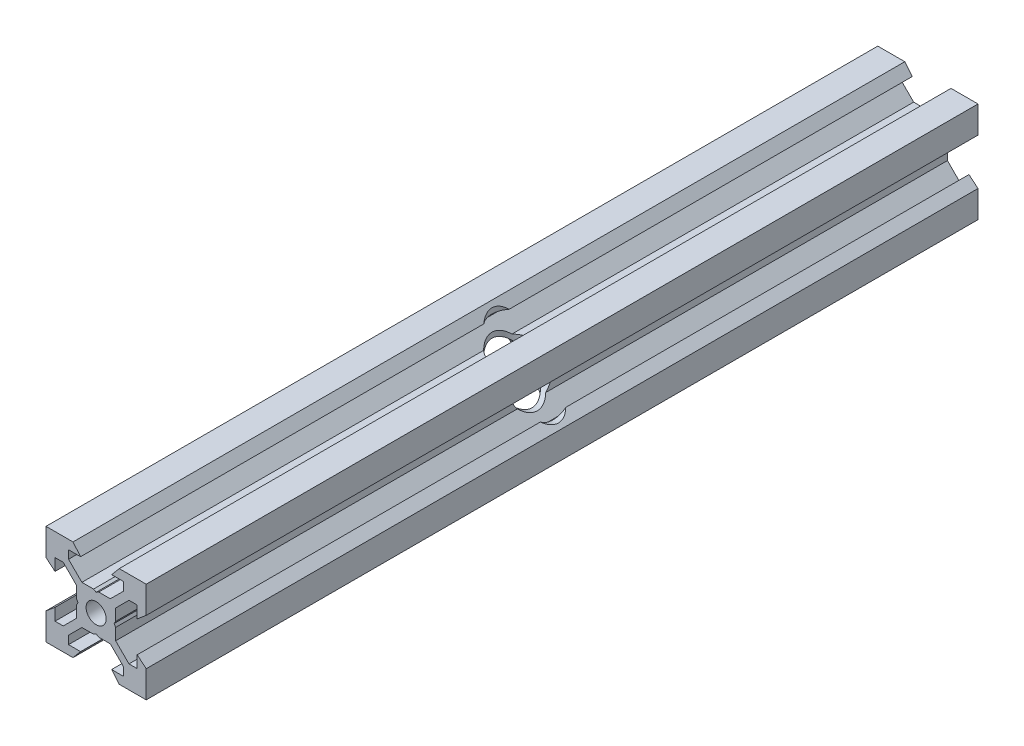
from build123d import *

# Parameters (mm, degrees)
SKETCH1_R               = 2
BOSS_EXTRUDE1_DEPTH     = 166
CUT_EXTRUDE1_DEPTH      = 167.601320523
CUT_EXTRUDE1_DEPTH_BACK = 167.601320523
SKETCH4_R               = 4
CUT_EXTRUDE2_DEPTH      = 167.601320623
CUT_EXTRUDE2_DEPTH_BACK = 167.601320623
SKETCH5_R               = 4


with BuildPart() as part:
    # Sketch1 → Boss-Extrude1 (new body)
    with BuildSketch(Plane.XY):
        Polygon((10, 10), (10, 4.610379336), (8.2, 3.1), (8.2, 5.5), (6.560660172, 5.5), (3.9, 2.839339828), (3.9, 0.519615242), (3.6, 0), (3.9, -0.519615242), (3.9, -2.839339828), (6.560660172, -5.5), (8.2, -5.5), (8.2, -3.1), (10, -4.610379336), (10, -10), (4.610379336, -10), (3.1, -8.2), (5.5, -8.2), (5.5, -6.560660172), (2.839339828, -3.9), (0.519615242, -3.9), (0, -3.6), (-0.519615242, -3.9), (-2.839339828, -3.9), (-5.5, -6.560660172), (-5.5, -8.2), (-3.1, -8.2), (-4.610379336, -10), (-10, -10), (-10, -4.610379336), (-8.2, -3.1), (-8.2, -5.5), (-6.560660172, -5.5), (-3.9, -2.839339828), (-3.9, -0.519615242), (-3.6, 0), (-3.9, 0.519615242), (-3.9, 2.839339828), (-6.560660172, 5.5), (-8.2, 5.5), (-8.2, 3.1), (-10, 4.610379336), (-10, 10), (-4.610379336, 10), (-3.1, 8.2), (-5.5, 8.2), (-5.5, 6.560660172), (-2.839339828, 3.9), (-0.519615242, 3.9), (0, 3.6), (0.519615242, 3.9), (2.839339828, 3.9), (5.5, 6.560660172), (5.5, 8.2), (3.1, 8.2), (4.610379336, 10), align=None)
        Circle(SKETCH1_R, mode=Mode.SUBTRACT)
    extrude(amount=BOSS_EXTRUDE1_DEPTH)

    # Sketch4 → Cut-Extrude1 (cut, two sides: drawn at the far end of the back side and taken through both)
    with BuildSketch(Plane(origin=(0, 0, 0), x_dir=(0, 0, -1), z_dir=(1, 0, 0)).offset(-CUT_EXTRUDE1_DEPTH_BACK)):
        with Locations((-83, 0)):
            Circle(SKETCH4_R)
    extrude(amount=CUT_EXTRUDE1_DEPTH + CUT_EXTRUDE1_DEPTH_BACK, mode=Mode.SUBTRACT)

    # Sketch5 → Cut-Extrude2 (cut, two sides: drawn at the far end of the back side and taken through both)
    with BuildSketch(Plane(origin=(0, 0, 0), x_dir=(1, 0, 0), z_dir=(0, 1, 0)).offset(-CUT_EXTRUDE2_DEPTH_BACK)):
        with Locations(Location((0, -83, 0), (0, 0, 270))):
            Circle(SKETCH5_R)
    extrude(amount=CUT_EXTRUDE2_DEPTH + CUT_EXTRUDE2_DEPTH_BACK, mode=Mode.SUBTRACT)


solid = part.part
